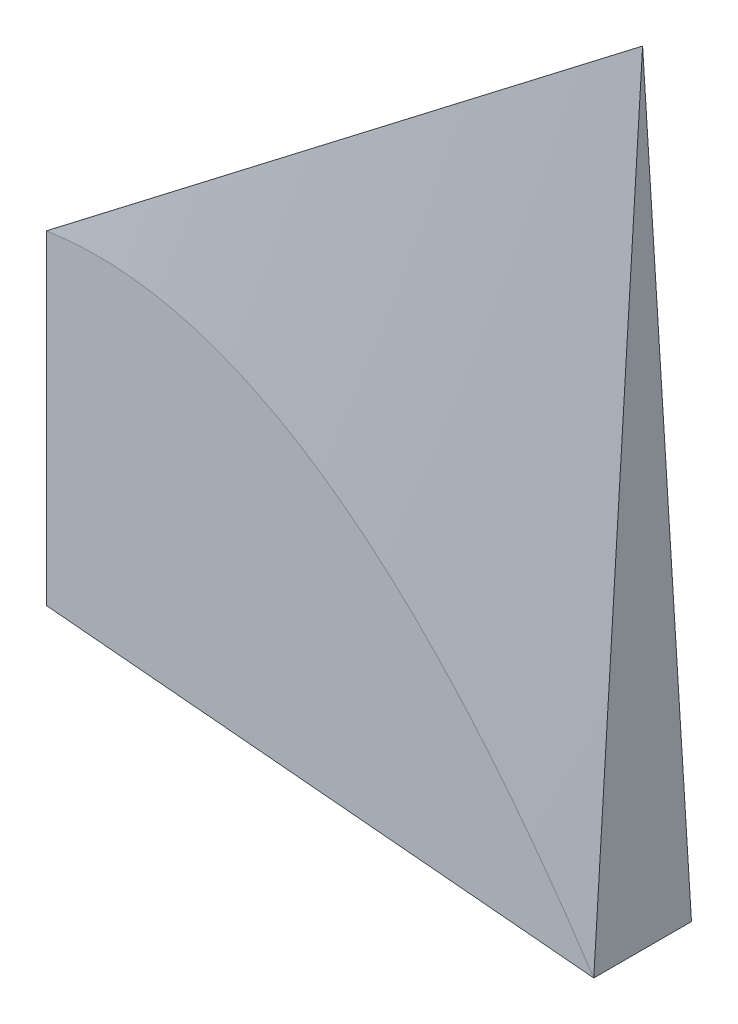
from build123d import *

# Parameters (mm, degrees)
SKETCH12_OUTSIDE_W = 83.236
SKETCH12_OUTSIDE_H = 32.236
CUT_EXTRUDE2_DEPTH = 64.470558


with BuildPart() as part:
    # Sketch11 → Loft1 section 0
    with BuildSketch(Plane(origin=(-118.389869674, 0, 0), x_dir=(0, 0, -1), z_dir=(1, 0, 0))):
        with BuildLine():
            Line((-5, 129.010177568), (0, 162.229328702))
            Line((0, 162.229328702), (5, 129.010177568))
            Line((5, 129.010177568), (-5, 129.010177568))
        make_face()
    # Sketch10 → Loft1 section 1
    with BuildSketch(Plane(origin=(-57.389869674, 0, 0), x_dir=(0, 0, -1), z_dir=(1, 0, 0))):
        with BuildLine():
            Line((-5, 129.010177568), (0, 209.106439296))
            Line((0, 209.106439296), (5, 129.010177568))
            Line((5, 129.010177568), (-5, 129.010177568))
        make_face()
    loft()

    # Sketch12 outside → Cut-Extrude2 (cut)
    with BuildSketch(Plane.XZ.offset(-129.010177568)):
        with Locations((-87.89, 0)):
            Rectangle(SKETCH12_OUTSIDE_W, SKETCH12_OUTSIDE_H)
        Polygon((-57.389869674, -5), (-118.389869674, 0), (-57.389869674, 5), align=None, mode=Mode.SUBTRACT)
    extrude(amount=-CUT_EXTRUDE2_DEPTH, mode=Mode.SUBTRACT)


solid = part.part
